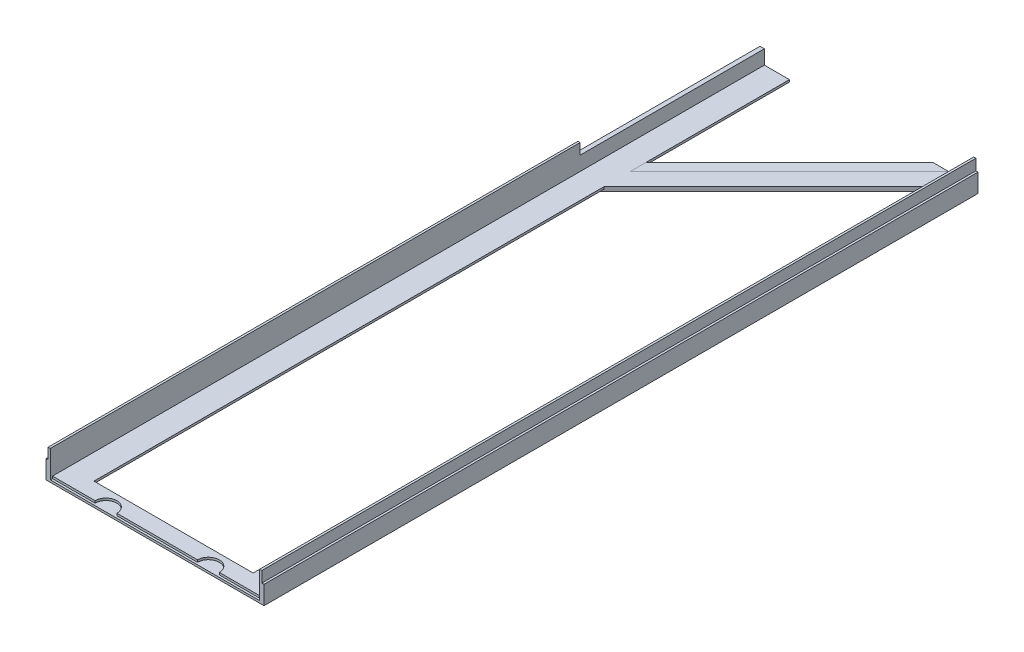
from build123d import *

# Parameters (mm, degrees)
BOSS_EXTRUDE1_DEPTH   = 327.5
BOSS_EXTRUDE1_2_DEPTH = 327.5
BOSS_EXTRUDE2_DEPTH   = 2
BOSS_EXTRUDE4_DEPTH   = 1
SKETCH4_W             = 100
SKETCH4_H             = 8.5
BOSS_EXTRUDE5_DEPTH   = 2
BOSS_EXTRUDE6_DEPTH   = 1
SKETCH6_R             = 5
SKETCH6_W             = 96
SKETCH6_H             = 1
CUT_EXTRUDE1_DEPTH    = 1
SKETCH7_W             = 1
SKETCH7_H             = 5
CUT_EXTRUDE2_DEPTH    = 84.5


with BuildPart() as part:
    # Sketch1 → Boss-Extrude1 (new body)
    with BuildSketch(Plane.XY):
        Polygon((0, 0), (0, 8.5), (1, 8.5), (1, 13.5), (2, 13.5), (2, 2), (13.5, 2), (13.5, 1), (8.5, 1), (8.5, 0), align=None)
    extrude(amount=BOSS_EXTRUDE1_DEPTH)



with BuildPart() as body_2:
    # Sketch1 → Boss-Extrude1 2 (new body)
    with BuildSketch(Plane.XY):
        Polygon((100, 0), (91.5, 0), (91.5, 1), (86.5, 1), (86.5, 2), (98, 2), (98, 13.5), (99, 13.5), (99, 8.5), (100, 8.5), align=None)
    extrude(amount=BOSS_EXTRUDE1_2_DEPTH)


with BuildPart() as part_1:
    add(part.part)

    add(body_2.part)  # Boss-Extrude2 merges body 2
    # Sketch2 → Boss-Extrude2 (add)
    with BuildSketch(Plane(origin=(0, 2, 0), x_dir=(1, 0, 0), z_dir=(0, 1, 0))):
        Polygon((86.5, 0), (13.5, -73), (13.5, -85.02081528), (86.5, -12.02081528), align=None)
    extrude(amount=-BOSS_EXTRUDE2_DEPTH)

    # Sketch3 → Boss-Extrude4 (add)
    with BuildSketch(Plane.XZ.offset(-1)):
        Polygon((13.5, 73), (13.5, 85.02081528), (8.5, 90.02081528), (8.5, 78), align=None)
        Polygon((86.5, 0), (86.5, 12.02081528), (91.5, 7.02081528), (91.5, 0), align=None)
    extrude(amount=BOSS_EXTRUDE4_DEPTH)

    # Sketch4 → Boss-Extrude5 (add)
    with BuildSketch(Plane.XZ):
        with Locations((50, 323.25)):
            Rectangle(SKETCH4_W, SKETCH4_H)
    extrude(amount=-BOSS_EXTRUDE5_DEPTH)

    # Sketch6 → Cut-Extrude1 (cut)
    with BuildSketch(Plane(origin=(0, 2, 0), x_dir=(1, 0, 0), z_dir=(0, 1, 0))):
        with Locations((26.5, -326.5)):
            Circle(SKETCH6_R)
        with Locations((73.5, -326.5)):
            Circle(SKETCH6_R)
        with Locations((50, -327)):
            Rectangle(SKETCH6_W, SKETCH6_H)
    extrude(amount=-CUT_EXTRUDE1_DEPTH, mode=Mode.SUBTRACT)

    # Sketch7 → Cut-Extrude2 (cut)
    with BuildSketch(Plane(origin=(0, 0, 0), x_dir=(-1, 0, 0), z_dir=(0, 0, -1))):
        with Locations((-1.5, 11)):
            Rectangle(SKETCH7_W, SKETCH7_H)
    extrude(amount=-CUT_EXTRUDE2_DEPTH, mode=Mode.SUBTRACT)


with BuildPart() as body_2_2:
    # Sketch5 → Boss-Extrude6 (new body)
    with BuildSketch(Plane(origin=(0, 2, 0), x_dir=(1, 0, 0), z_dir=(0, 1, 0))):
        Polygon((13.5, -65.928932188), (79.428932188, 0), (86.5, 0), (13.5, -73), align=None)
    extrude(amount=-BOSS_EXTRUDE6_DEPTH)


solid = Compound([part_1.part, body_2_2.part])
